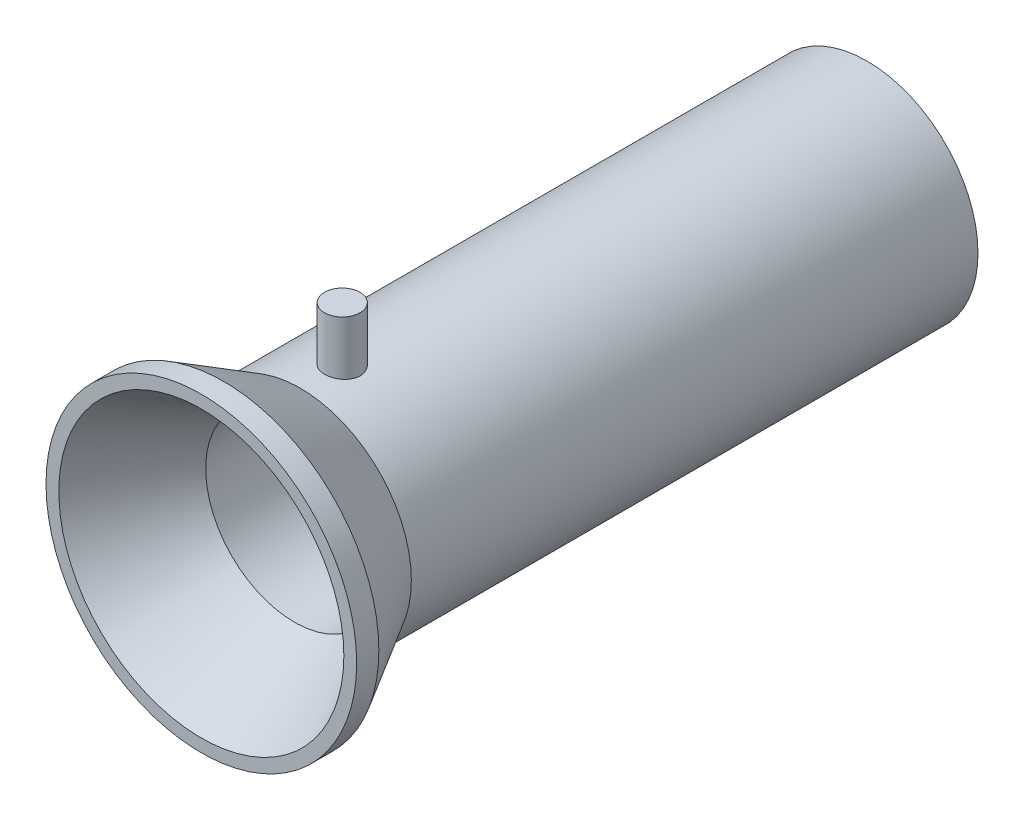
from build123d import *

# Parameters (mm, degrees)
BOSS_EXTRUDE1_REACH      = 130.098
BOSS_EXTRUDE1_END_RADIUS = 25
SKETCH2_R                = 4
SKETCH3_R                = 25
SKETCH3_R_2              = 20
BOSS_EXTRUDE2_DEPTH      = 50


with BuildPart() as part:
    # Sketch1 → Revolve1 (revolve)
    with BuildSketch(Plane(origin=(0, 0, 0), x_dir=(0, 0, -1), z_dir=(1, 0, 0)), mode=Mode.PRIVATE) as revolve1_sk:
        Polygon((22.320508076, 25), (100, 25), (100, 20), (20.980762114, 20), (0, 32.113248654), (0, 35), (5, 35), align=None)
    revolve(revolve1_sk.sketch.rotate(Axis((0, 0, 0), (0, 0, -1)), 90), axis=Axis((0, 0, 0), (0, 0, -1)))

    # Boss-Extrude1: up to this cylinder (the profile starts outside it)
    boss_extrude1_end = Plane(origin=(0, 0, -31.75833), z_dir=(0, 0, 1)) * Cylinder(BOSS_EXTRUDE1_END_RADIUS, 311.196, mode=Mode.PRIVATE)
    # Sketch2 → Boss-Extrude1 (add, up to the surface)
    with BuildSketch(Plane(origin=(0, 37, 0), x_dir=(1, 0, 0), z_dir=(0, 1, 0)), mode=Mode.PRIVATE) as boss_extrude1_sk1:
        with Locations(Location((0, 31.758330249, 0), (0, 0, 270))):
            Circle(SKETCH2_R)
    boss_extrude1_tool1 = extrude(boss_extrude1_sk1.sketch, amount=-BOSS_EXTRUDE1_REACH, mode=Mode.PRIVATE) - boss_extrude1_end
    boss_extrude1 = boss_extrude1_tool1.solids().sort_by_distance((0, 37, -31.75833))[0]
    add(boss_extrude1)

    # Mirror1: Boss-Extrude1 across plane
    add(boss_extrude1.mirror(Plane.ZX))

    # Sketch3 → Boss-Extrude2 (add)
    with BuildSketch(Plane(origin=(0, 0, -100), x_dir=(-1, 0, 0), z_dir=(0, 0, -1))):
        with Locations(Location((0, 0, 0), (0, 0, 180))):
            Circle(SKETCH3_R)
        with Locations(Location((0, 0, 0), (0, 0, 180))):
            Circle(SKETCH3_R_2, mode=Mode.SUBTRACT)
    extrude(amount=BOSS_EXTRUDE2_DEPTH)


solid = part.part
